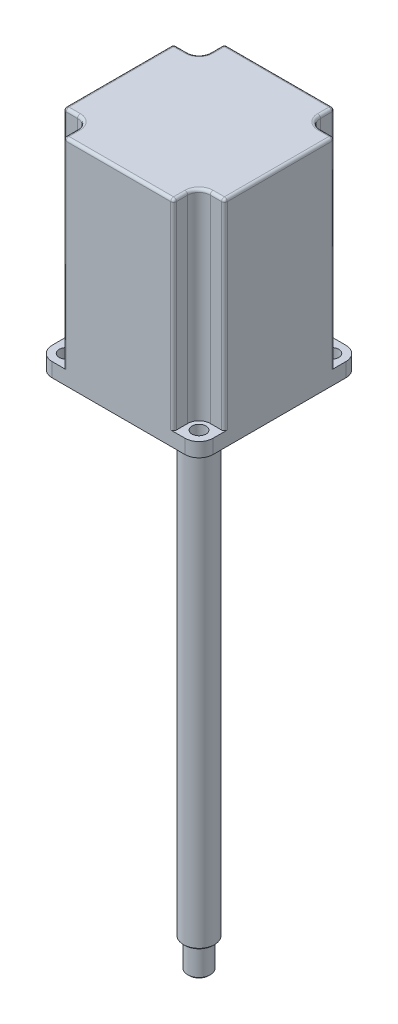
from build123d import *

# Parameters (mm, degrees)
SKETCH1_W                = 57
SKETCH1_H                = 57
EXTRUDE1_DEPTH           = 76
F_5_0_5_DIAMETER_HOLE1_D = 5
SKETCH6_R                = 4
SKETCH6_R_2              = 2.5
EXTRUDE4_DEPTH           = 71
FILLET1_R                = 5
SKETCH7_R                = 3
EXTRUDE5_DEPTH           = 101
SKETCH8_R                = 15
EXTRUDE6_DEPTH           = 3
FILLET2_R                = 1
SKETCH9_R                = 5.5
BOSS_EXTRUDE1_DEPTH      = 174
CHAMFER1_SIZE            = 0.5
SKETCH10_R               = 4
BOSS_EXTRUDE2_DEPTH      = 10
CHAMFER2_SIZE            = 0.5


with BuildPart() as part:
    # Sketch1 → Extrude1 (new body)
    with BuildSketch(Plane(origin=(0, 0, 0), x_dir=(1, 0, 0), z_dir=(0, 1, 0))):
        Rectangle(SKETCH1_W, SKETCH1_H)
    extrude(amount=EXTRUDE1_DEPTH)

    # Ø5.0 (5) Diameter Hole1 (through all)
    with Locations(Plane.XZ):
        with Locations((-23.5, 23.5), (23.5, 23.5), (23.5, -23.5), (-23.5, -23.5)):
            Hole(F_5_0_5_DIAMETER_HOLE1_D / 2)

    # Sketch6 → Extrude4 (cut)
    # profile 1 of 12: a face of its own
    with BuildSketch(Plane(origin=(0, 76, 0), x_dir=(1, 0, 0), z_dir=(0, 1, 0))):
        Polygon((-28.5, 28.5), (-19.5, 28.5), (-19.5, 32.511741208), (-33.908905561, 32.511741208), (-33.908905561, 19.5), (-28.5, 19.5), align=None)
    # profile 2 of 12: a face of its own
    with BuildSketch(Plane(origin=(0, 76, 0), x_dir=(1, 0, 0), z_dir=(0, 1, 0))):
        with BuildLine():
            ThreePointArc((-23.5, 19.5), (-26.328427125, 26.328427125), (-19.5, 23.5))
            Line((-19.5, 23.5), (-19.5, 28.5))
            Line((-19.5, 28.5), (-28.5, 28.5))
            Line((-28.5, 28.5), (-28.5, 19.5))
            Line((-28.5, 19.5), (-23.5, 19.5))
        make_face()
    # profile 3 of 12: a face of its own
    with BuildSketch(Plane(origin=(0, 76, 0), x_dir=(1, 0, 0), z_dir=(0, 1, 0))):
        with Locations((-23.5, 23.5)):
            Circle(SKETCH6_R)
        with Locations(Location((-23.5, 23.5, 0), (0, 0, 90))):
            Circle(SKETCH6_R_2, mode=Mode.SUBTRACT)
    # profile 4 of 12: a face of its own
    with BuildSketch(Plane(origin=(0, 76, 0), x_dir=(1, 0, 0), z_dir=(0, 1, 0))):
        Polygon((19.5, 36.471560472), (19.5, 28.5), (28.5, 28.5), (28.5, 19.5), (41.168352552, 19.5), (41.168352552, 36.471560472), align=None)
    # profile 5 of 12: a face of its own
    with BuildSketch(Plane(origin=(0, 76, 0), x_dir=(1, 0, 0), z_dir=(0, 1, 0))):
        with BuildLine():
            Line((28.5, 28.5), (19.5, 28.5))
            Line((19.5, 28.5), (19.5, 23.5))
            ThreePointArc((19.5, 23.5), (23.5, 27.5), (27.5, 23.5))
            ThreePointArc((27.5, 23.5), (26.328427125, 20.671572875), (23.5, 19.5))
            Line((23.5, 19.5), (28.5, 19.5))
            Line((28.5, 19.5), (28.5, 28.5))
        make_face()
    # profile 6 of 12: a face of its own
    with BuildSketch(Plane(origin=(0, 76, 0), x_dir=(1, 0, 0), z_dir=(0, 1, 0))):
        with Locations((23.5, 23.5)):
            Circle(SKETCH6_R)
        with Locations(Location((23.5, 23.5, 0), (0, 0, 90))):
            Circle(SKETCH6_R_2, mode=Mode.SUBTRACT)
    # profile 7 of 12: a face of its own
    with BuildSketch(Plane(origin=(0, 76, 0), x_dir=(1, 0, 0), z_dir=(0, 1, 0))):
        with Locations((23.5, -23.5)):
            Circle(SKETCH6_R)
        with Locations(Location((23.5, -23.5, 0), (0, 0, 90))):
            Circle(SKETCH6_R_2, mode=Mode.SUBTRACT)
    # profile 8 of 12: a face of its own
    with BuildSketch(Plane(origin=(0, 76, 0), x_dir=(1, 0, 0), z_dir=(0, 1, 0))):
        with BuildLine():
            Line((28.5, -28.5), (28.5, -19.5))
            Line((28.5, -19.5), (23.5, -19.5))
            ThreePointArc((23.5, -19.5), (26.328427125, -20.671572875), (27.5, -23.5))
            ThreePointArc((27.5, -23.5), (23.5, -27.5), (19.5, -23.5))
            Line((19.5, -23.5), (19.5, -28.5))
            Line((19.5, -28.5), (28.5, -28.5))
        make_face()
    # profile 9 of 12: a face of its own
    with BuildSketch(Plane(origin=(0, 76, 0), x_dir=(1, 0, 0), z_dir=(0, 1, 0))):
        Polygon((44.252209519, -19.5), (28.5, -19.5), (28.5, -28.5), (19.5, -28.5), (19.5, -40.050429997), (44.252209519, -40.050429997), align=None)
    # profile 10 of 12: a face of its own
    with BuildSketch(Plane(origin=(0, 76, 0), x_dir=(1, 0, 0), z_dir=(0, 1, 0))):
        Polygon((-28.5, -28.5), (-28.5, -19.5), (-37.670786859, -19.5), (-37.670786859, -37.828231874), (-19.5, -37.828231874), (-19.5, -28.5), align=None)
    # profile 11 of 12: a face of its own
    with BuildSketch(Plane(origin=(0, 76, 0), x_dir=(1, 0, 0), z_dir=(0, 1, 0))):
        with BuildLine():
            Line((-23.5, -19.5), (-28.5, -19.5))
            Line((-28.5, -19.5), (-28.5, -28.5))
            Line((-28.5, -28.5), (-19.5, -28.5))
            Line((-19.5, -28.5), (-19.5, -23.5))
            ThreePointArc((-19.5, -23.5), (-26.328427125, -26.328427125), (-23.5, -19.5))
        make_face()
    # profile 12 of 12: a face of its own
    with BuildSketch(Plane(origin=(0, 76, 0), x_dir=(1, 0, 0), z_dir=(0, 1, 0))):
        with Locations((-23.5, -23.5)):
            Circle(SKETCH6_R)
        with Locations(Location((-23.5, -23.5, 0), (0, 0, 90))):
            Circle(SKETCH6_R_2, mode=Mode.SUBTRACT)
    extrude(amount=-EXTRUDE4_DEPTH, mode=Mode.SUBTRACT)

    # Fillet1
    fillet1_edges = [part.edges().sort_by_distance(p)[0] for p in [
        (-28.5, 2.5, 28.5),
        (-28.5, 2.5, -28.5),
        (28.5, 2.5, -28.5),
        (28.5, 2.5, 28.5),
    ]]
    fillet(fillet1_edges, radius=FILLET1_R)



with BuildPart() as body_2:
    # Sketch7 → Extrude5 (new body)
    with BuildSketch(Plane(origin=(0, 76, 0), x_dir=(1, 0, 0), z_dir=(0, 1, 0))):
        with Locations(Location((0, 0, 0), (0, 0, 270))):
            Circle(SKETCH7_R)
    extrude(amount=-EXTRUDE5_DEPTH)


with BuildPart() as part_1:
    add(part.part)

    add(body_2.part)  # Extrude6 merges body 2
    # Sketch8 → Extrude6 (add)
    with BuildSketch(Plane.XZ):
        with Locations(Location((0, 0, 0), (0, 0, 270))):
            Circle(SKETCH8_R)
    extrude(amount=EXTRUDE6_DEPTH)

    # Fillet2
    fillet2_edges = [part_1.edges().sort_by_distance(p)[0] for p in [
        (-28.5, 40.5, 19.5),
        (0, 76, 28.5),
        (-19.5, 40.5, 28.5),
        (-19.5, 76, 26),
        (-20.671572875, 76, 20.671572875),
        (-26, 76, 19.5),
        (-28.5, 76, 0),
        (-28.5, 40.5, -19.5),
        (-19.5, 40.5, -28.5),
        (-19.5, 76, -26),
        (-26, 76, -19.5),
        (-20.671572875, 76, -20.671572875),
        (0, 76, -28.5),
        (19.5, 76, -26),
        (26, 76, -19.5),
        (20.671572875, 76, -20.671572875),
        (19.5, 40.5, -28.5),
        (28.5, 40.5, -19.5),
        (19.5, 40.5, 28.5),
        (28.5, 76, 0),
        (26, 76, 19.5),
        (19.5, 76, 26),
        (20.671572875, 76, 20.671572875),
        (28.5, 40.5, 19.5),
    ]]
    fillet(fillet2_edges, radius=FILLET2_R)

    # Sketch9 → Boss-Extrude1 (add)
    with BuildSketch(Plane.XZ):
        with Locations(Location((0, 0, 0), (0, 0, 270))):
            Circle(SKETCH9_R)
    extrude(amount=BOSS_EXTRUDE1_DEPTH)

    # Chamfer1
    chamfer1_edges = [part_1.edges().sort_by_distance(p)[0] for p in [
        (0, -174, 5.5),
    ]]
    chamfer(chamfer1_edges, length=CHAMFER1_SIZE)

    # Sketch10 → Boss-Extrude2 (add)
    with BuildSketch(Plane.XZ.offset(174)):
        with Locations(Location((0, 0, 0), (0, 0, 270))):
            Circle(SKETCH10_R)
    extrude(amount=BOSS_EXTRUDE2_DEPTH)

    # Chamfer2
    chamfer2_edges = [part_1.edges().sort_by_distance(p)[0] for p in [
        (0, -184, 4),
    ]]
    chamfer(chamfer2_edges, length=CHAMFER2_SIZE)


solid = part_1.part
